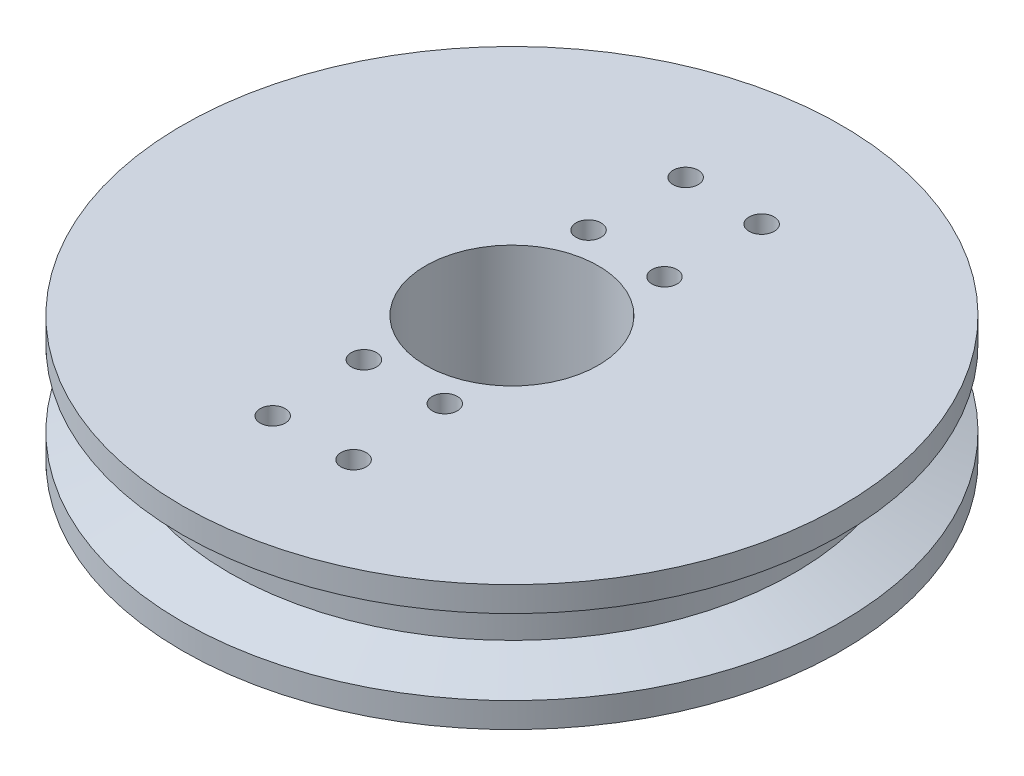
from build123d import *

# Parameters (mm, degrees)
SKETCH2_R          = 4
CUT_EXTRUDE1_DEPTH = 154.785564992


with BuildPart() as part:
    # Sketch1 → Revolve1 (revolve)
    with BuildSketch(Plane.XY, mode=Mode.PRIVATE) as revolve1_sk:
        Polygon((27.5, -1.48189165), (27.5, -41.48189165), (105, -41.48189165), (105, -33.48189165), (90, -27.48189165), (90, -15.48189165), (105, -9.48189165), (105, -1.48189165), align=None)
    revolve(revolve1_sk.sketch.rotate(Axis((0, 0, 0), (0, -1, 0)), 90), axis=Axis((0, 0, 0), (0, -1, 0)))

    # Sketch2 → Cut-Extrude1 (cut, through all)
    with BuildSketch(Plane(origin=(0, -1.48189165, 0), x_dir=(1, 0, 0), z_dir=(0, 1, 0))):
        with Locations(Location((-11.379541398, -35.786671236, 0), (0, 0, 270))):
            Circle(SKETCH2_R)
        with Locations(Location((13.608078504, -35, 0), (0, 0, 270))):
            Circle(SKETCH2_R)
        with Locations(Location((14.552551693, -65, 0), (0, 0, 270))):
            Circle(SKETCH2_R)
        with Locations(Location((-10.435068209, -65.786671236, 0), (0, 0, 270))):
            Circle(SKETCH2_R)
    cut_extrude1 = extrude(amount=-CUT_EXTRUDE1_DEPTH, mode=Mode.SUBTRACT)

    # Mirror1: Cut-Extrude1 across plane
    add(cut_extrude1.mirror(Plane.XY), mode=Mode.SUBTRACT)


solid = part.part
